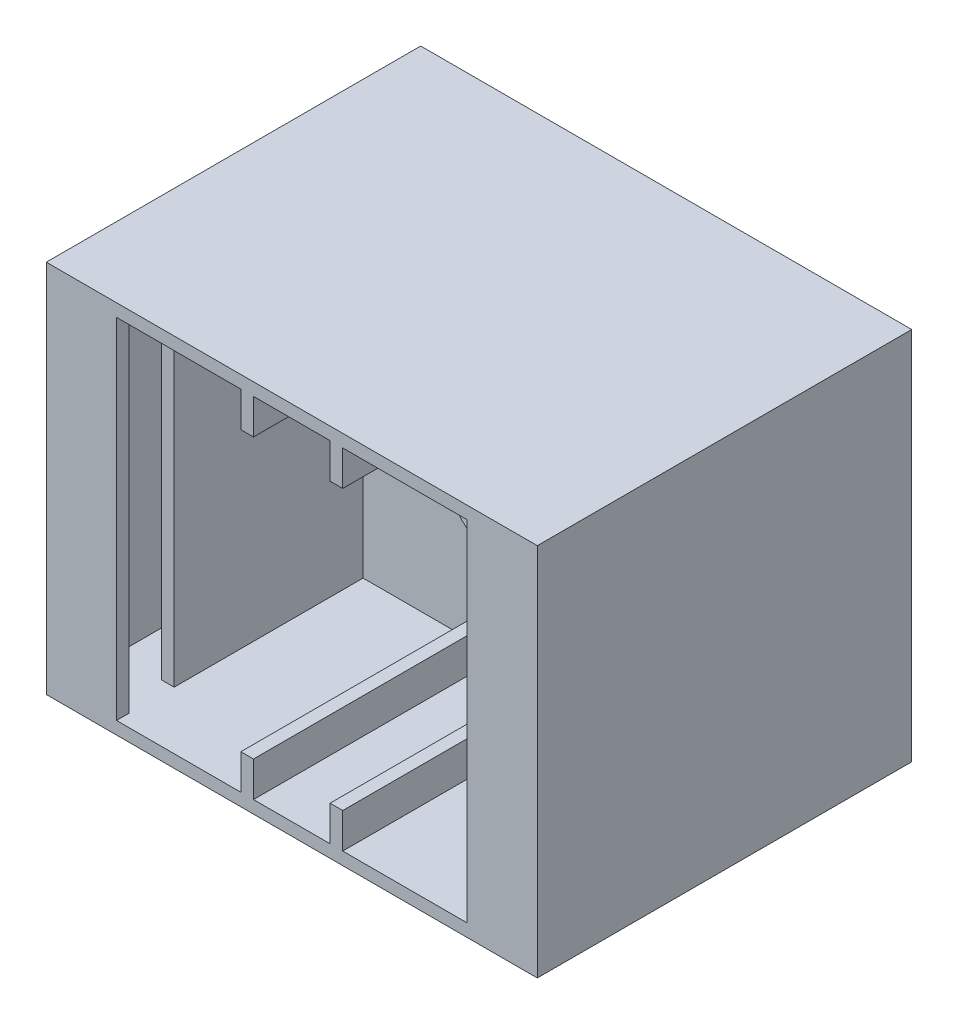
from build123d import *

# Parameters (mm, degrees)
SKETCH1_W           = 499
SKETCH1_H           = 18
SKETCH1_W_2         = 18
SKETCH1_H_2         = 64
BOSS_EXTRUDE1_DEPTH = 515
SKETCH4_W           = 699
SKETCH4_H           = 533
BOSS_EXTRUDE2_DEPTH = 18
SKETCH5_W           = 699
SKETCH5_H           = 533
BOSS_EXTRUDE3_DEPTH = 18
SKETCH7_W           = 18
SKETCH7_H           = 351
BOSS_EXTRUDE4_DEPTH = 50
SKETCH8_W           = 18
SKETCH8_H           = 351
BOSS_EXTRUDE5_DEPTH = 50
SKETCH9_R           = 152.5
CUT_EXTRUDE1_DEPTH  = 50


with BuildPart() as part:
    # Sketch1 → Boss-Extrude1 (new body)
    with BuildSketch(Plane(origin=(0, 0, 0), x_dir=(1, 0, 0), z_dir=(0, 1, 0))):
        Polygon((249.5, -272.327471245), (331.5, -272.327471245), (331.5, 224.672528755), (-331.5, 224.672528755), (-331.5, -272.327471245), (-249.5, -272.327471245), (-249.5, -290.327471245), (-349.5, -290.327471245), (-349.5, 242.672528755), (349.5, 242.672528755), (349.5, -290.327471245), (249.5, -290.327471245), align=None)
        Polygon((249.5, -208.327471245), (267.5, -208.327471245), (267.5, 160.672528755), (72.5, 160.672528755), (72.5, 142.672528755), (249.5, 142.672528755), align=None)
        with Locations((0, 69.672528755)):
            Rectangle(SKETCH1_W, SKETCH1_H)
        with Locations((0, 192.672528755)):
            Rectangle(SKETCH1_W_2, SKETCH1_H_2)
        Polygon((-249.5, -208.327471245), (-267.5, -208.327471245), (-267.5, 160.672528755), (-72.5, 160.672528755), (-72.5, 142.672528755), (-249.5, 142.672528755), align=None)
    extrude(amount=BOSS_EXTRUDE1_DEPTH)

    # Sketch4 → Boss-Extrude2 (add)
    with BuildSketch(Plane(origin=(0, 0, 0), x_dir=(1, 0, 0), z_dir=(0, 1, 0))):
        with Locations((0, -23.827471245)):
            Rectangle(SKETCH4_W, SKETCH4_H)
    extrude(amount=BOSS_EXTRUDE2_DEPTH)

    # Sketch5 → Boss-Extrude3 (add)
    with BuildSketch(Plane(origin=(0, 515, 0), x_dir=(1, 0, 0), z_dir=(0, 1, 0))):
        with Locations((0, -23.827471245)):
            Rectangle(SKETCH5_W, SKETCH5_H)
    extrude(amount=BOSS_EXTRUDE3_DEPTH)

    # Sketch7 → Boss-Extrude4 (add)
    with BuildSketch(Plane(origin=(0, 18, 0), x_dir=(1, 0, 0), z_dir=(0, 1, 0))):
        with Locations((63.5, -114.827471245)):
            Rectangle(SKETCH7_W, SKETCH7_H)
        with Locations((-63.5, -114.827471245)):
            Rectangle(SKETCH7_W, SKETCH7_H)
    extrude(amount=BOSS_EXTRUDE4_DEPTH)

    # Sketch8 → Boss-Extrude5 (add)
    with BuildSketch(Plane.XZ.offset(-515)):
        with Locations((-63.5, 114.827471245)):
            Rectangle(SKETCH8_W, SKETCH8_H)
        with Locations((63.5, 114.827471245)):
            Rectangle(SKETCH8_W, SKETCH8_H)
    extrude(amount=BOSS_EXTRUDE5_DEPTH)

    # Sketch9 → Cut-Extrude1 (cut)
    with BuildSketch(Plane.XY.offset(-60.672528755)):
        with Locations((0, 266.5)):
            Circle(SKETCH9_R)
    extrude(amount=-CUT_EXTRUDE1_DEPTH, mode=Mode.SUBTRACT)


solid = part.part
